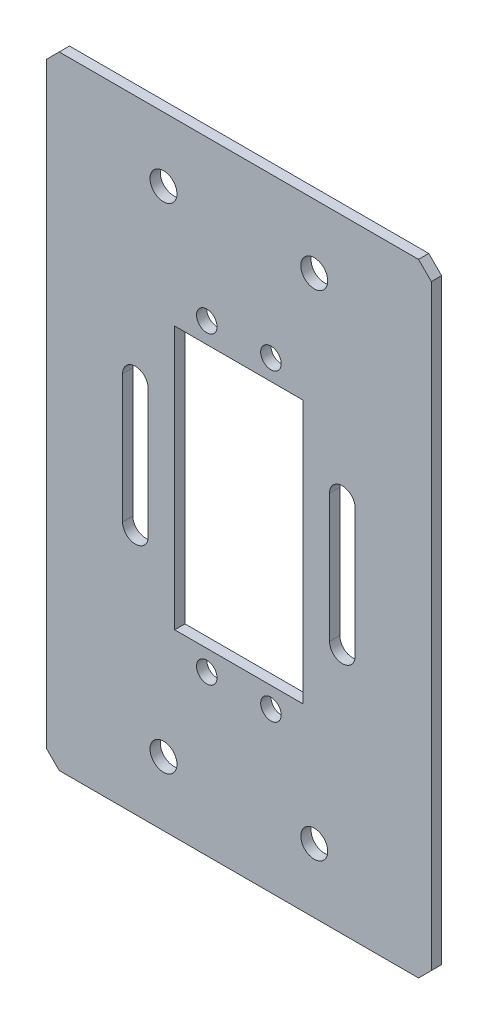
from build123d import *

# Parameters (mm, degrees)
SKETCH_1_R      = 2.1
SKETCH_1_R_2    = 1.6
SKETCH_1_W      = 20
SKETCH_1_H      = 41
EXTRUDE_1_DEPTH = 1.6


with BuildPart() as part:
    # 草图1 → 凸台-拉伸1 (new body)
    with BuildSketch(Plane.XY):
        Polygon((-30, 46.5), (-28, 48.5), (28, 48.5), (30, 46.5), (30, -46.5), (28, -48.5), (-28, -48.5), (-30, -46.5), align=None)
        with Locations((-11.75, 38.5)):
            Circle(SKETCH_1_R, mode=Mode.SUBTRACT)
        with Locations((-5, 23.7)):
            Circle(SKETCH_1_R_2, mode=Mode.SUBTRACT)
        with Locations(Location((-5, -23.7, 0), (0, 0, 180))):
            Circle(SKETCH_1_R_2, mode=Mode.SUBTRACT)
        with Locations(Location((-11.75, -38.5, 0), (0, 0, 180))):
            Circle(SKETCH_1_R, mode=Mode.SUBTRACT)
        with Locations((11.75, -38.5)):
            Circle(SKETCH_1_R, mode=Mode.SUBTRACT)
        with Locations((5, -23.7)):
            Circle(SKETCH_1_R_2, mode=Mode.SUBTRACT)
        with Locations(Location((5, 23.7, 0), (0, 0, 180))):
            Circle(SKETCH_1_R_2, mode=Mode.SUBTRACT)
        with Locations(Location((11.75, 38.5, 0), (0, 0, 180))):
            Circle(SKETCH_1_R, mode=Mode.SUBTRACT)
        with BuildLine():
            Line((-18.12722641, 10), (-18.12722641, -10))
            ThreePointArc((-18.12722641, -10), (-16.12722641, -12), (-14.12722641, -10))
            Line((-14.12722641, -10), (-14.12722641, 10))
            ThreePointArc((-14.12722641, 10), (-16.12722641, 12), (-18.12722641, 10))
        make_face(mode=Mode.SUBTRACT)
        Rectangle(SKETCH_1_W, SKETCH_1_H, mode=Mode.SUBTRACT)
        with BuildLine():
            Line((18.12722641, 10), (18.12722641, -10))
            ThreePointArc((18.12722641, -10), (16.12722641, -12), (14.12722641, -10))
            Line((14.12722641, -10), (14.12722641, 10))
            ThreePointArc((14.12722641, 10), (16.12722641, 12), (18.12722641, 10))
        make_face(mode=Mode.SUBTRACT)
    extrude(amount=EXTRUDE_1_DEPTH)


solid = part.part
